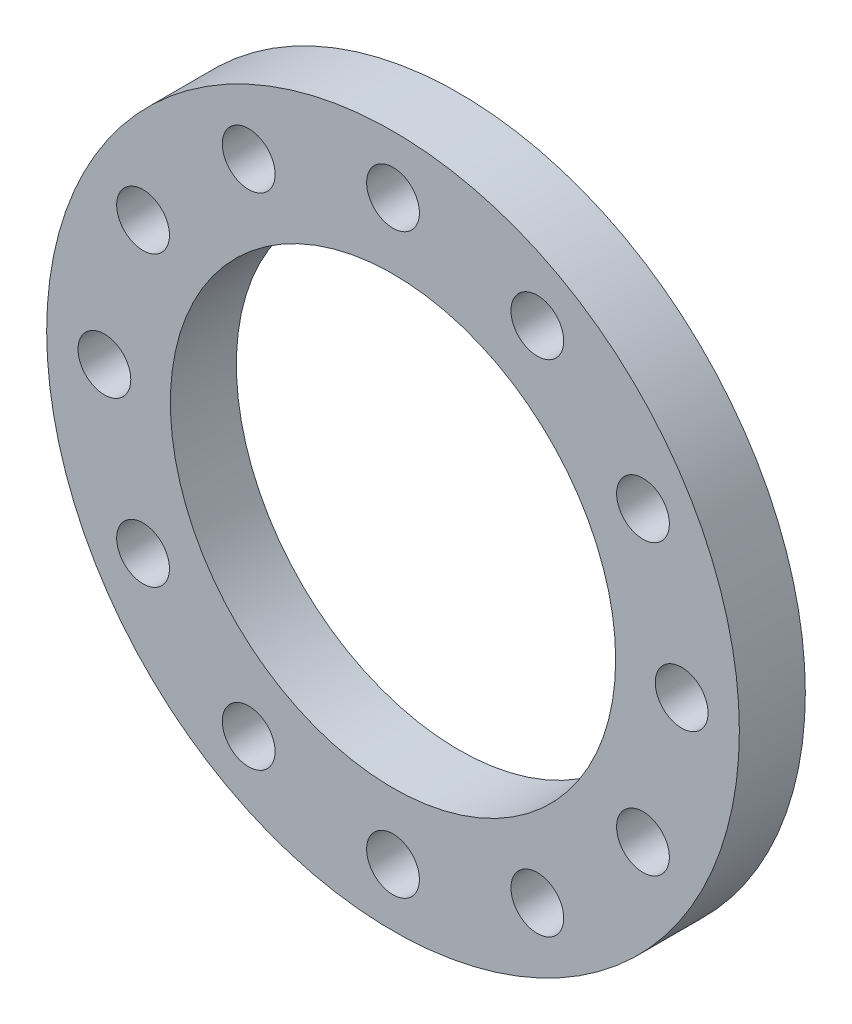
from build123d import *

# Parameters (mm, degrees)
SKETCH_1_R      = 21
SKETCH_1_R_2    = 13.5
SKETCH_1_R_3    = 1.6
EXTRUDE_1_DEPTH = 4


with BuildPart() as part:
    # 草图1 → 凸台-拉伸1 (new body)
    with BuildSketch(Plane.XY):
        Circle(SKETCH_1_R)
        Circle(SKETCH_1_R_2, mode=Mode.SUBTRACT)
        with Locations((0, 17.5)):
            Circle(SKETCH_1_R_3, mode=Mode.SUBTRACT)
        with Locations((17.5, 0)):
            Circle(SKETCH_1_R_3, mode=Mode.SUBTRACT)
        with Locations((0, -17.5)):
            Circle(SKETCH_1_R_3, mode=Mode.SUBTRACT)
        with Locations((-17.5, 0)):
            Circle(SKETCH_1_R_3, mode=Mode.SUBTRACT)
        with Locations((15.155444566, -8.75)):
            Circle(SKETCH_1_R_3, mode=Mode.SUBTRACT)
        with Locations((8.75, 15.155444566)):
            Circle(SKETCH_1_R_3, mode=Mode.SUBTRACT)
        with Locations((-15.155444566, 8.75)):
            Circle(SKETCH_1_R_3, mode=Mode.SUBTRACT)
        with Locations((-8.75, -15.155444566)):
            Circle(SKETCH_1_R_3, mode=Mode.SUBTRACT)
        with Locations((-15.155444566, -8.75)):
            Circle(SKETCH_1_R_3, mode=Mode.SUBTRACT)
        with Locations((8.75, -15.155444566)):
            Circle(SKETCH_1_R_3, mode=Mode.SUBTRACT)
        with Locations((15.155444566, 8.75)):
            Circle(SKETCH_1_R_3, mode=Mode.SUBTRACT)
        with Locations((-8.75, 15.155444566)):
            Circle(SKETCH_1_R_3, mode=Mode.SUBTRACT)
    extrude(amount=EXTRUDE_1_DEPTH)


solid = part.part
